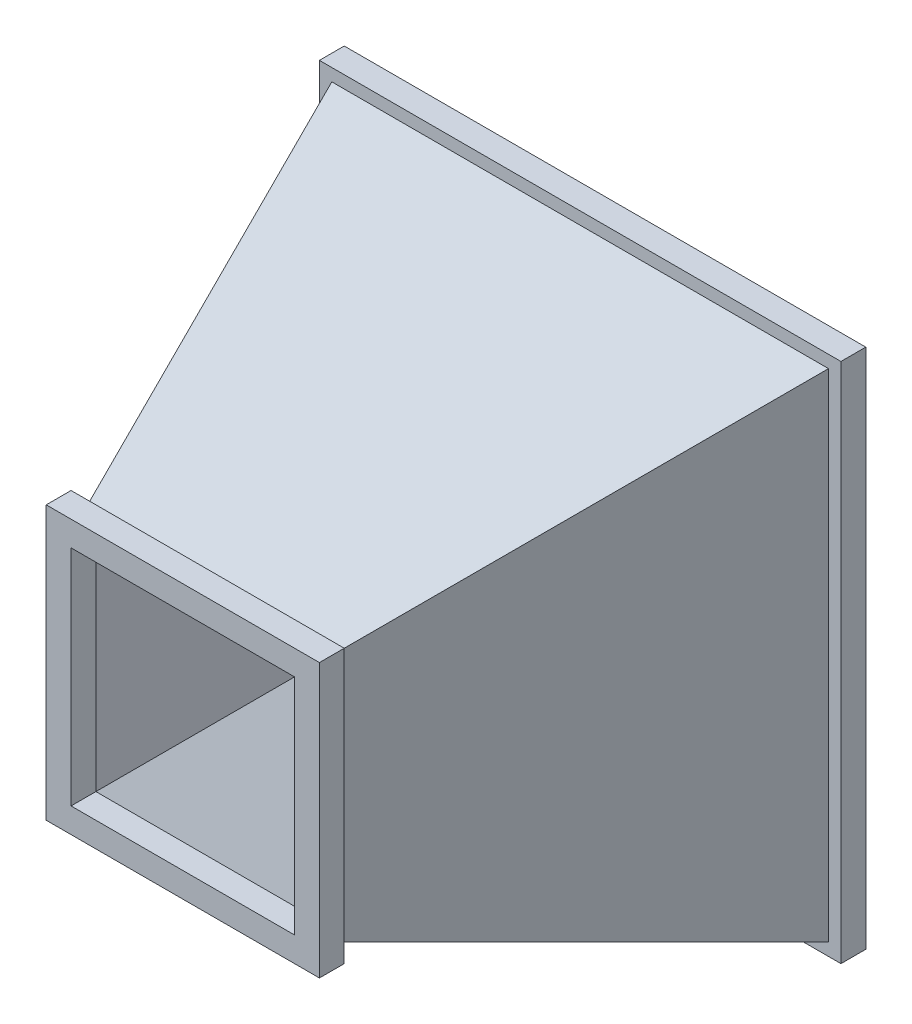
from build123d import *

# Parameters (mm, degrees)
SKETCH5_W           = 279.4
SKETCH5_H           = 279.4
SKETCH5_W_2         = 228.6
SKETCH5_H_2         = 228.6
BOSS_EXTRUDE1_DEPTH = 25.4
SKETCH6_W           = 533.4
SKETCH6_H           = 533.4
SKETCH6_W_2         = 482.6
SKETCH6_H_2         = 482.6
BOSS_EXTRUDE2_DEPTH = 25.4


with BuildPart() as part:
    # Sketch2 → Loft1 section 0
    with BuildSketch(Plane.XY.offset(381)):
        with BuildLine():
            Line((-127, -127), (127, -127))
            Line((127, -127), (127, 127))
            Line((127, 127), (-127, 127))
            Line((-127, 127), (-127, -127))
        make_face()
    # Sketch1 → Loft1 section 1
    with BuildSketch(Plane.XY):
        with BuildLine():
            Line((-254, -254), (254, -254))
            Line((254, -254), (254, 254))
            Line((254, 254), (-254, 254))
            Line((-254, 254), (-254, -254))
        make_face()
    loft()

    # Sketch4 → Cut-Loft1 section 0
    with BuildSketch(Plane(origin=(0, 0, 0), x_dir=(-1, 0, 0), z_dir=(0, 0, -1))):
        with BuildLine():
            Line((241.3, -241.3), (241.3, 241.3))
            Line((241.3, 241.3), (-241.3, 241.3))
            Line((-241.3, 241.3), (-241.3, -241.3))
            Line((-241.3, -241.3), (241.3, -241.3))
        make_face()
    # Sketch3 → Cut-Loft1 section 1
    with BuildSketch(Plane.XY.offset(381)):
        with BuildLine():
            Line((114.3, -114.3), (114.3, 114.3))
            Line((114.3, 114.3), (-114.3, 114.3))
            Line((-114.3, 114.3), (-114.3, -114.3))
            Line((-114.3, -114.3), (114.3, -114.3))
        make_face()
    loft(mode=Mode.SUBTRACT)

    # Sketch5 → Boss-Extrude1 (add)
    with BuildSketch(Plane.XY.offset(381)):
        Rectangle(SKETCH5_W, SKETCH5_H)
        Rectangle(SKETCH5_W_2, SKETCH5_H_2, mode=Mode.SUBTRACT)
    extrude(amount=BOSS_EXTRUDE1_DEPTH)

    # Sketch6 → Boss-Extrude2 (add)
    with BuildSketch(Plane(origin=(0, 0, 0), x_dir=(-1, 0, 0), z_dir=(0, 0, -1))):
        Rectangle(SKETCH6_W, SKETCH6_H)
        Rectangle(SKETCH6_W_2, SKETCH6_H_2, mode=Mode.SUBTRACT)
    extrude(amount=BOSS_EXTRUDE2_DEPTH)


solid = part.part
